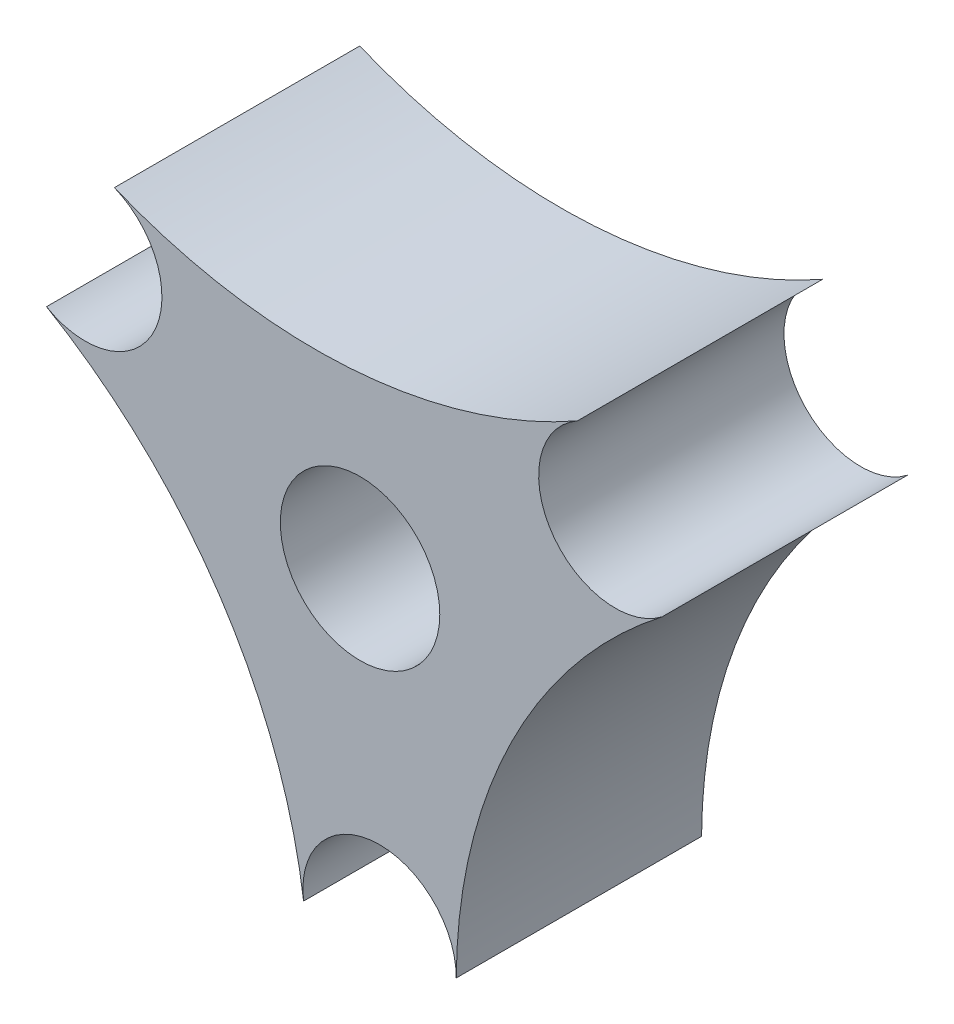
from build123d import *

# Parameters (mm, degrees)
SKETCH1_R           = 52
BOSS_EXTRUDE1_DEPTH = 160


with BuildPart() as part:
    # Sketch1 → Boss-Extrude1 (new body)
    with BuildSketch(Plane.XY):
        with BuildLine():
            ThreePointArc((197.049087256, 71.252073557), (124.865338893, 83.118272018), (141.773845489, 154.28991383))
            ThreePointArc((141.773845489, 154.28991383), (-7.006959316, 109.835222819), (-160.230649401, 135.023478578))
            ThreePointArc((-160.230649401, 135.023478578), (-137.69027653, 116.613373396), (-129.22027271, 88.769892699))
            ThreePointArc((-129.22027271, 88.769892699), (-154.363500473, 45.386245158), (-204.505907669, 45.634794871))
            ThreePointArc((-204.505907669, 45.634794871), (-91.616613534, -60.98581618), (-36.818437855, -206.275552135))
            ThreePointArc((-36.818437855, -206.275552135), (9.384990663, -149.70648333), (62.733154186, -199.594255389))
            ThreePointArc((62.733154186, -199.594255389), (62.732881184, -199.759482947), (62.73206218, -199.924708701))
            ThreePointArc((62.73206218, -199.924708701), (98.62357285, -48.849406639), (197.049087256, 71.252073557))
        make_face()
        Circle(SKETCH1_R, mode=Mode.SUBTRACT)
    extrude(amount=BOSS_EXTRUDE1_DEPTH)


solid = part.part
